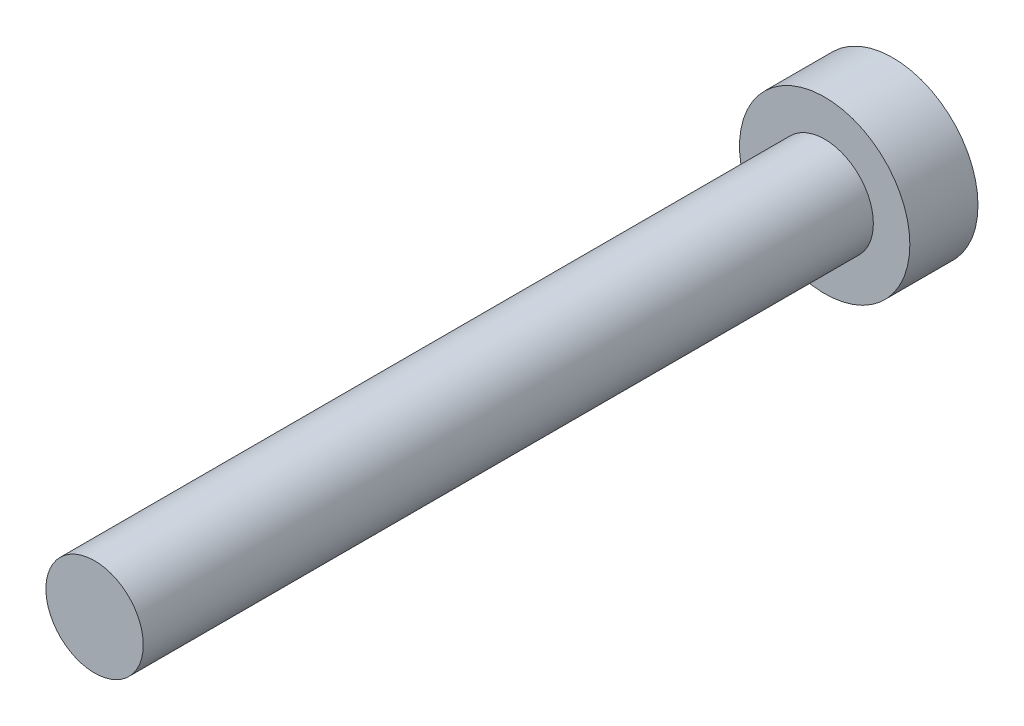
from build123d import *

# Parameters (mm, degrees)
F_01_START                  = -2.8
S01_LOW_SOCKET_HEAD_R       = 3.5
F_01_LOW_SOCKET_HEAD_DEPTH  = 2.8
S02_NOMINAL_M4_SHANK_R      = 2
F_02_NOMINAL_M4_SHANK_DEPTH = 30
F_03_START                  = -2.9
F_03_HEX_DRIVE_RECESS_DEPTH = 1.65


with BuildPart() as part:
    # S01 - Low socket head → 01 - Low socket head (new body)
    with BuildSketch(Plane.XY.offset(F_01_START)):
        Circle(S01_LOW_SOCKET_HEAD_R)
    extrude(amount=F_01_LOW_SOCKET_HEAD_DEPTH)

    # S02 - Nominal M4 shank → 02 - Nominal M4 shank (add)
    with BuildSketch(Plane.XY):
        Circle(S02_NOMINAL_M4_SHANK_R)
    extrude(amount=F_02_NOMINAL_M4_SHANK_DEPTH)

    # S03 - Hex drive recess → 03 - Hex drive recess (cut)
    with BuildSketch(Plane.XY.offset(F_03_START)):
        Polygon((1.443375673, 0), (0.721687836, 1.25), (-0.721687836, 1.25), (-1.443375673, 0), (-0.721687836, -1.25), (0.721687836, -1.25), align=None)
    extrude(amount=F_03_HEX_DRIVE_RECESS_DEPTH, mode=Mode.SUBTRACT)


solid = part.part
